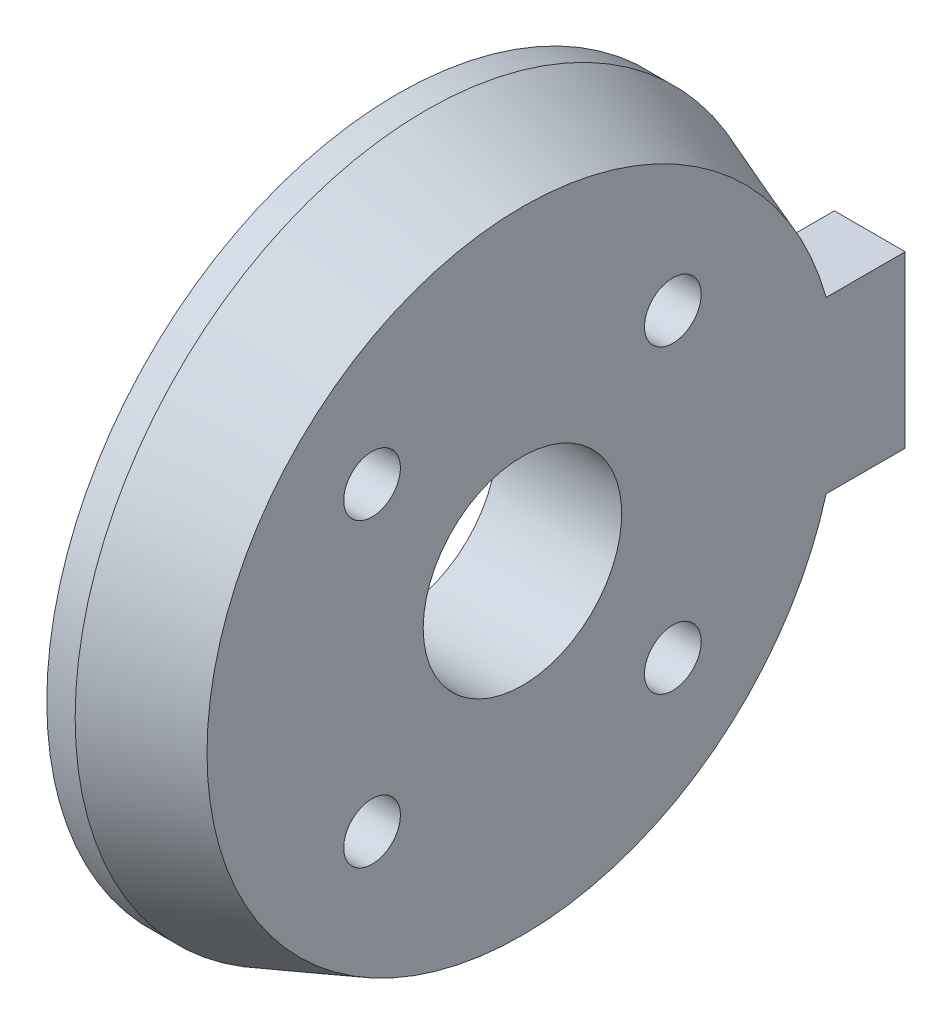
from build123d import *

# Parameters (mm, degrees)
SKETCH3_R           = 2
CUT_EXTRUDE1_DEPTH  = 5
SKETCH4_W           = 12
SKETCH4_H           = 12
BOSS_EXTRUDE1_DEPTH = 5


with BuildPart() as part:
    # Sketch2 → Revolve1 (revolve)
    with BuildSketch(Plane.XY, mode=Mode.PRIVATE) as revolve1_sk:
        Polygon((0, 24.75), (2, 24.75), (8.8, 22.25), (8.8, 7), (0, 7), align=None)
    revolve(revolve1_sk.sketch.rotate(Axis((0, 0, 0), (1, 0, 0)), 90), axis=Axis((0, 0, 0), (1, 0, 0)))

    # Sketch3 → Cut-Extrude1 (cut)
    with BuildSketch(Plane(origin=(8.8, 0, 0), x_dir=(0, 0, -1), z_dir=(1, 0, 0))):
        with Locations((10.606601718, 10.606601718)):
            Circle(SKETCH3_R)
        with Locations((10.606601718, -10.606601718)):
            Circle(SKETCH3_R)
        with Locations((-10.606601718, -10.606601718)):
            Circle(SKETCH3_R)
        with Locations((-10.606601718, 10.606601718)):
            Circle(SKETCH3_R)
    extrude(amount=-CUT_EXTRUDE1_DEPTH, mode=Mode.SUBTRACT)

    # Sketch4 → Boss-Extrude1 (add)
    with BuildSketch(Plane(origin=(8.8, 0, 0), x_dir=(0, 0, -1), z_dir=(1, 0, 0))):
        with Locations((21, 0)):
            Rectangle(SKETCH4_W, SKETCH4_H)
    extrude(amount=-BOSS_EXTRUDE1_DEPTH)


solid = part.part
